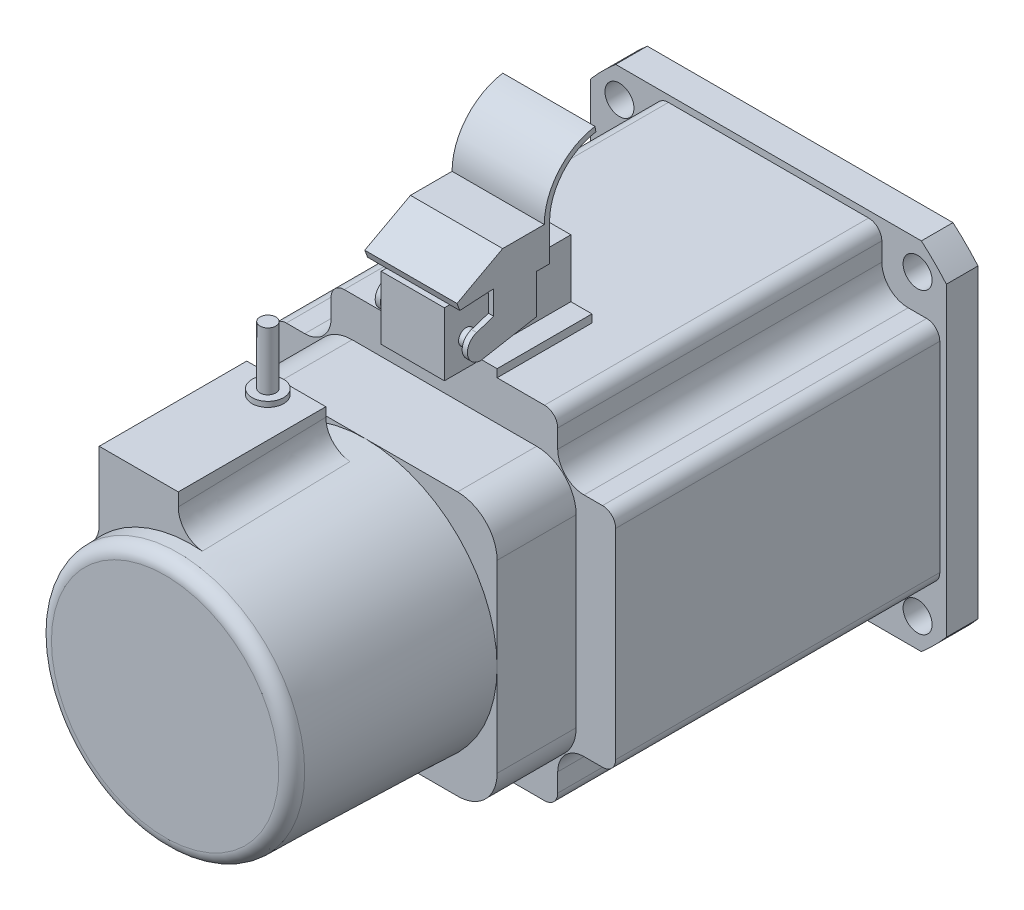
from build123d import *

# Parameters (mm, degrees)
SKETCH_2_W               = 135
SKETCH_2_H               = 135
EXTRUDE_1_DEPTH          = 12
SKETCH_3_W               = 130
SKETCH_3_H               = 130
EXTRUDE_2_DEPTH          = 153
SKETCH_4_W               = 22
SKETCH_4_H               = 22
CUT_EXTRUDE_1_DEPTH      = 153
FILLET_1_R               = 10
FILLET_2_R               = 5
SKETCH_9_W               = 30
SKETCH_9_H               = 37.096125782
EXTRUDE_3_DEPTH          = 56
FILLET_3_R               = 10
FILLET_4_R               = 5
SKETCH_11_OUTSIDE_W      = 207.446
SKETCH_11_OUTSIDE_H      = 207.446
SKETCH_11_OUTSIDE_R      = 89
CUT_EXTRUDE_2_DEPTH      = 48
SKETCH_12_R              = 5.5
CUT_EXTRUDE_3_DEPTH      = 48
PATTERN_CIRCULAR_1_COUNT = 4
CHAMFER_2_SIZE           = 1
CUT_EXTRUDE_4_REACH      = 269.717
CUT_EXTRUDE_4_END_RADIUS = 11
CUT_EXTRUDE_START        = -8.5
EXTRUDE_START            = 13.5
EXTRUDE_5_DEPTH          = 13.5
FILLET_5_R               = 2.5
SKETCH_17_OUTSIDE_W      = 207.446
SKETCH_17_OUTSIDE_H      = 207.446
CUT_EXTRUDE_5_DEPTH      = 30
FILLET_6_R               = 10
SKETCH_19_W              = 48
SKETCH_19_H              = 24
EXTRUDE_6_DEPTH          = 12
SKETCH_20_W              = 40
SKETCH_20_H              = 3
EXTRUDE_7_DEPTH          = 36
EXTRUDE_8_DEPTH          = 17.5
EXTRUDE_1_2_DEPTH        = 17.5
SKETCH_23_R              = 6
EXTRUDE_9_DEPTH          = 2
SKETCH_24_R              = 3
EXTRUDE_10_DEPTH         = 22
SKETCH_25_W              = 3.5
SKETCH_25_H              = 18.65860818
CUT_EXTRUDE_6_DEPTH      = 248.744185597
EXTRUDE_START_2          = -33
SKETCH_27_R              = 2.98609351
EXTRUDE_11_DEPTH         = 31
CHAMFER_3_SIZE           = 0.5
HOLE_WIZARD_M6_1_D       = 5
HOLE_WIZARD_M6_1_DEPTH   = 11
HOLE_WIZARD_M6_1_TIP     = 1.502151548


with BuildPart() as part:
    # 草图1 → 旋转1 (revolve)
    with BuildSketch(Plane(origin=(0, 0, 0), x_dir=(1, 0, 0), z_dir=(0, 1, 0)), mode=Mode.PRIVATE) as revolve_1_sk:
        Polygon((0, 0), (0, 55), (11, 55), (11, 5), (14.8, 5), (14.8, 3), (57.15, 3), (57.15, 0), align=None)
    revolve(revolve_1_sk.sketch.rotate(Axis((0, 0, 0), (0, 0, 1)), 180), axis=Axis((0, 0, 0), (0, 0, 1)))

    # 草图2 → Extrude 1 (add)
    with BuildSketch(Plane.XY):
        Rectangle(SKETCH_2_W, SKETCH_2_H)
    extrude(amount=EXTRUDE_1_DEPTH)

    # 草图3 → 凸台-拉伸2 (add)
    with BuildSketch(Plane.XY.offset(12)):
        Rectangle(SKETCH_3_W, SKETCH_3_H)
    extrude(amount=EXTRUDE_2_DEPTH)

    # 草图4 → 切除-拉伸1 (cut)
    with BuildSketch(Plane.XY.offset(165)):
        with Locations((54, 54)):
            Rectangle(SKETCH_4_W, SKETCH_4_H)
        with Locations((-54, 54)):
            Rectangle(SKETCH_4_W, SKETCH_4_H)
        with Locations((54, -54)):
            Rectangle(SKETCH_4_W, SKETCH_4_H)
        with Locations((-54, -54)):
            Rectangle(SKETCH_4_W, SKETCH_4_H)
    extrude(amount=-CUT_EXTRUDE_1_DEPTH, mode=Mode.SUBTRACT)

    # 圆角1
    fillet_1_edges = [part.edges().sort_by_distance(p)[0] for p in [
        (-43, 43, 88.5),
        (43, 43, 88.5),
        (43, -43, 88.5),
        (-43, -43, 88.5),
    ]]
    fillet(fillet_1_edges, radius=FILLET_1_R)

    # 圆角2
    fillet_2_edges = [part.edges().sort_by_distance(p)[0] for p in [
        (-65, 43, 88.5),
        (-43, 65, 88.5),
        (43, 65, 88.5),
        (65, 43, 88.5),
        (65, -43, 88.5),
        (43, -65, 88.5),
        (-43, -65, 88.5),
        (-65, -43, 88.5),
    ]]
    fillet(fillet_2_edges, radius=FILLET_2_R)

    # 草图8 → 旋转2 (revolve)
    with BuildSketch(Plane(origin=(0, 0, 0), x_dir=(1, 0, 0), z_dir=(0, 1, 0)), mode=Mode.PRIVATE) as revolve_2_sk:
        Polygon((0, -165), (50, -165), (48, -241), (0, -241), align=None)
    revolve(revolve_2_sk.sketch.rotate(Axis((0, 0, 0), (0, 0, 1)), 180), axis=Axis((0, 0, 0), (0, 0, 1)))

    # 草图9 → 凸台-拉伸3 (add)
    with BuildSketch(Plane.XY.offset(231)):
        with Locations((-20, 44.451937109)):
            Rectangle(SKETCH_9_W, SKETCH_9_H)
    extrude(amount=-EXTRUDE_3_DEPTH)

    # 圆角3
    fillet_3_edges = [part.edges().sort_by_distance(p)[0] for p in [
        (-5, 48.744230387, 203.000001549),
    ]]
    fillet(fillet_3_edges, radius=FILLET_3_R)

    # 圆角4
    fillet_4_edges = [part.edges().sort_by_distance(p)[0] for p in [
        (48, 0, 241),
    ]]
    fillet(fillet_4_edges, radius=FILLET_4_R)

    # 草图11 outside → 切除-拉伸2 (cut)
    with BuildSketch(Plane(origin=(0, 0, 0), x_dir=(-1, 0, 0), z_dir=(0, 0, -1))):
        Rectangle(SKETCH_11_OUTSIDE_W, SKETCH_11_OUTSIDE_H)
        Circle(SKETCH_11_OUTSIDE_R, mode=Mode.SUBTRACT)
    extrude(amount=-CUT_EXTRUDE_2_DEPTH, mode=Mode.SUBTRACT)

    # 草图12 → 切除-拉伸3 (cut)
    with BuildSketch(Plane(origin=(0, 0, 0), x_dir=(-1, 0, 0), z_dir=(0, 0, -1))):
        with Locations((-56.568542495, 56.568542495)):
            Circle(SKETCH_12_R)
    cut_extrude_3 = extrude(amount=-CUT_EXTRUDE_3_DEPTH, mode=Mode.SUBTRACT)

    # 阵列(圆周)1: 切除-拉伸3 ×4 about axis
    pattern_circular_1_axis = Axis((0, 0, 0), (0, 0, 1))
    for i in range(1, PATTERN_CIRCULAR_1_COUNT):
        add(cut_extrude_3.rotate(pattern_circular_1_axis, i * 360 / PATTERN_CIRCULAR_1_COUNT), mode=Mode.SUBTRACT)

    # 倒角2
    chamfer_2_edges = [part.edges().sort_by_distance(p)[0] for p in [
        (11, 0, -55),
    ]]
    chamfer(chamfer_2_edges, length=CHAMFER_2_SIZE)

    # 切除-拉伸4: up to this cylinder (the profile starts inside it)
    cut_extrude_4_end = Plane(origin=(0, 0, -31), z_dir=(0, 0, -1)) * Cylinder(CUT_EXTRUDE_4_END_RADIUS, 562.434, mode=Mode.PRIVATE)
    # 草图14 → 切除-拉伸4 (cut, up to the surface)
    with BuildSketch(Plane(origin=(0, 0, 0), x_dir=(1, 0, 0), z_dir=(0, 1, 0)).offset(CUT_EXTRUDE_START), mode=Mode.PRIVATE) as cut_extrude_4_sk1:
        with BuildLine():
            Line((3, 49), (3, 13))
            ThreePointArc((3, 13), (0, 10), (-3, 13))
            Line((-3, 13), (-3, 49))
            ThreePointArc((-3, 49), (0, 52), (3, 49))
        make_face()
    cut_extrude_4_tool1 = extrude(cut_extrude_4_sk1.sketch, amount=-CUT_EXTRUDE_4_REACH, mode=Mode.PRIVATE) & cut_extrude_4_end
    add(cut_extrude_4_tool1.solids().sort_by_distance((0, -8.5, -31))[0], mode=Mode.SUBTRACT)

    # 草图15 → 凸台-拉伸5 (add)
    with BuildSketch(Plane(origin=(0, 0, 0), x_dir=(1, 0, 0), z_dir=(0, 1, 0)).offset(EXTRUDE_START)):
        with BuildLine():
            Line((3, 49), (3, 13))
            ThreePointArc((3, 13), (0, 10), (-3, 13))
            Line((-3, 13), (-3, 49))
            ThreePointArc((-3, 49), (0, 52), (3, 49))
        make_face()
    extrude(amount=-EXTRUDE_5_DEPTH)

    # 圆角5
    fillet_5_edges = [part.edges().sort_by_distance(p)[0] for p in [
        (11, 0, -5),
    ]]
    fillet(fillet_5_edges, radius=FILLET_5_R)

    # 草图17 outside → 切除-拉伸5 (cut)
    with BuildSketch(Plane.XY.offset(165)):
        Rectangle(SKETCH_17_OUTSIDE_W, SKETCH_17_OUTSIDE_H)
        with BuildLine():
            Line((-35, -50), (35, -50))
            ThreePointArc((35, -50), (45.606601718, -45.606601718), (50, -35))
            Line((50, -35), (50, 35))
            ThreePointArc((50, 35), (45.606601718, 45.606601718), (35, 50))
            Line((35, 50), (-35, 50))
            ThreePointArc((-35, 50), (-45.606601718, 45.606601718), (-50, 35))
            Line((-50, 35), (-50, -35))
            ThreePointArc((-50, -35), (-45.606601718, -45.606601718), (-35, -50))
        make_face(mode=Mode.SUBTRACT)
    extrude(amount=-CUT_EXTRUDE_5_DEPTH, mode=Mode.SUBTRACT)

    # 圆角6
    fillet_6_edges = [part.edges().sort_by_distance(p)[0] for p in [
        (-35, 34.29284474, 203.000310069),
    ]]
    fillet(fillet_6_edges, radius=FILLET_6_R)



with BuildPart() as body_2:
    # 草图19 → 凸台-拉伸6 (new, symmetric)
    with BuildSketch(Plane(origin=(0, 0, 0), x_dir=(0, 0, -1), z_dir=(1, 0, 0))):
        with Locations((-123, 78)):
            Rectangle(SKETCH_19_W, SKETCH_19_H)
    extrude(amount=EXTRUDE_6_DEPTH, both=True)


with BuildPart() as part_1:
    add(part.part)

    add(body_2.part)  # 凸台-拉伸7 merges body 2
    # 草图20 → 凸台-拉伸7 (add)
    with BuildSketch(Plane.XY.offset(135)):
        with Locations((0, 66.5)):
            Rectangle(SKETCH_20_W, SKETCH_20_H)
    extrude(amount=-EXTRUDE_7_DEPTH)

    # 草图21 → 凸台-拉伸8 (add, symmetric)
    with BuildSketch(Plane(origin=(0, 0, 0), x_dir=(0, 0, -1), z_dir=(1, 0, 0))):
        with BuildLine():
            Line((-133.79196102, 83.35605607), (-140.24383379, 81.244047944))
            ThreePointArc((-140.24383379, 81.244047944), (-143.70125828, 75.58108638), (-138.653564253, 71.274846396))
            Line((-138.653564253, 71.274846396), (-117.454142719, 75.110014997))
            Line((-117.454142719, 75.110014997), (-117.454142719, 90))
            Line((-117.454142719, 90), (-112.588222915, 90))
            Line((-112.588222915, 90), (-112.588222915, 103.91211337))
            Line((-112.588222915, 103.91211337), (-130.390368537, 103.91211337))
            Line((-130.390368537, 103.91211337), (-147.717790276, 94.536316675))
            Line((-147.717790276, 94.536316675), (-146.649661539, 91.687973376))
            Line((-146.649661539, 91.687973376), (-133.79196102, 92.429729444))
            Line((-133.79196102, 92.429729444), (-133.79196102, 83.35605607))
        make_face()
    extrude(amount=EXTRUDE_8_DEPTH, both=True)

    # 草图22 → Extrude 1 2 (add, symmetric)
    with BuildSketch(Plane(origin=(0, 0, 0), x_dir=(0, 0, -1), z_dir=(1, 0, 0))):
        with BuildLine():
            ThreePointArc((-112.588222915, 103.91211337), (-107.604326242, 117.475222011), (-95.024242171, 124.584274468))
            Line((-95.024242171, 124.584274468), (-95.347263945, 126.558016329))
            ThreePointArc((-95.347263945, 126.558016329), (-109.128472486, 118.770203951), (-114.588222915, 103.91211337))
            Line((-114.588222915, 103.91211337), (-112.588222915, 103.91211337))
        make_face()
    extrude(amount=EXTRUDE_1_2_DEPTH, both=True)

    # 草图23 → 凸台-拉伸9 (add)
    with BuildSketch(Plane(origin=(0, 63, 0), x_dir=(1, 0, 0), z_dir=(0, 1, 0))):
        with Locations(Location((-20, -182, 0), (0, 0, 270))):
            Circle(SKETCH_23_R)
    extrude(amount=EXTRUDE_9_DEPTH)

    # 草图24 → 凸台-拉伸10 (add)
    with BuildSketch(Plane(origin=(0, 65, 0), x_dir=(1, 0, 0), z_dir=(0, 1, 0))):
        with Locations(Location((-20, -182, 0), (0, 0, 270))):
            Circle(SKETCH_24_R)
    extrude(amount=EXTRUDE_10_DEPTH)

    # 草图25 → 切除-拉伸6 (cut, through all)
    with BuildSketch(Plane.XY.offset(147)):
        with Locations((-13.75, 80.604150486)):
            Rectangle(SKETCH_25_W, SKETCH_25_H)
        with Locations((13.75, 80.604150486)):
            Rectangle(SKETCH_25_W, SKETCH_25_H)
    extrude(amount=-CUT_EXTRUDE_6_DEPTH, mode=Mode.SUBTRACT)

    # 草图27 → 凸台-拉伸11 (add)
    with BuildSketch(Plane.ZY.offset(17.5).offset(EXTRUDE_START_2)):
        with Locations(Location((138.653650179, 76.386271966, 0), (0, 0, 180))):
            Circle(SKETCH_27_R)
    extrude(amount=EXTRUDE_11_DEPTH)

    # 倒角3
    chamfer_3_edges = [part_1.edges().sort_by_distance(p)[0] for p in [
        (57.15, 0, -3),
    ]]
    chamfer(chamfer_3_edges, length=CHAMFER_3_SIZE)

    # M6 螺纹孔1
    with Locations(Plane(origin=(0, 0, -55), x_dir=(-1, 0, 0), z_dir=(0, 0, -1))):
        with Locations((0, 0)):
            Hole(HOLE_WIZARD_M6_1_D / 2, depth=HOLE_WIZARD_M6_1_DEPTH)
            with Locations((0, 0, -(HOLE_WIZARD_M6_1_DEPTH + HOLE_WIZARD_M6_1_TIP / 2))):  # 118° drill point
                Cone(0, HOLE_WIZARD_M6_1_D / 2, HOLE_WIZARD_M6_1_TIP, mode=Mode.SUBTRACT)


solid = part_1.part
